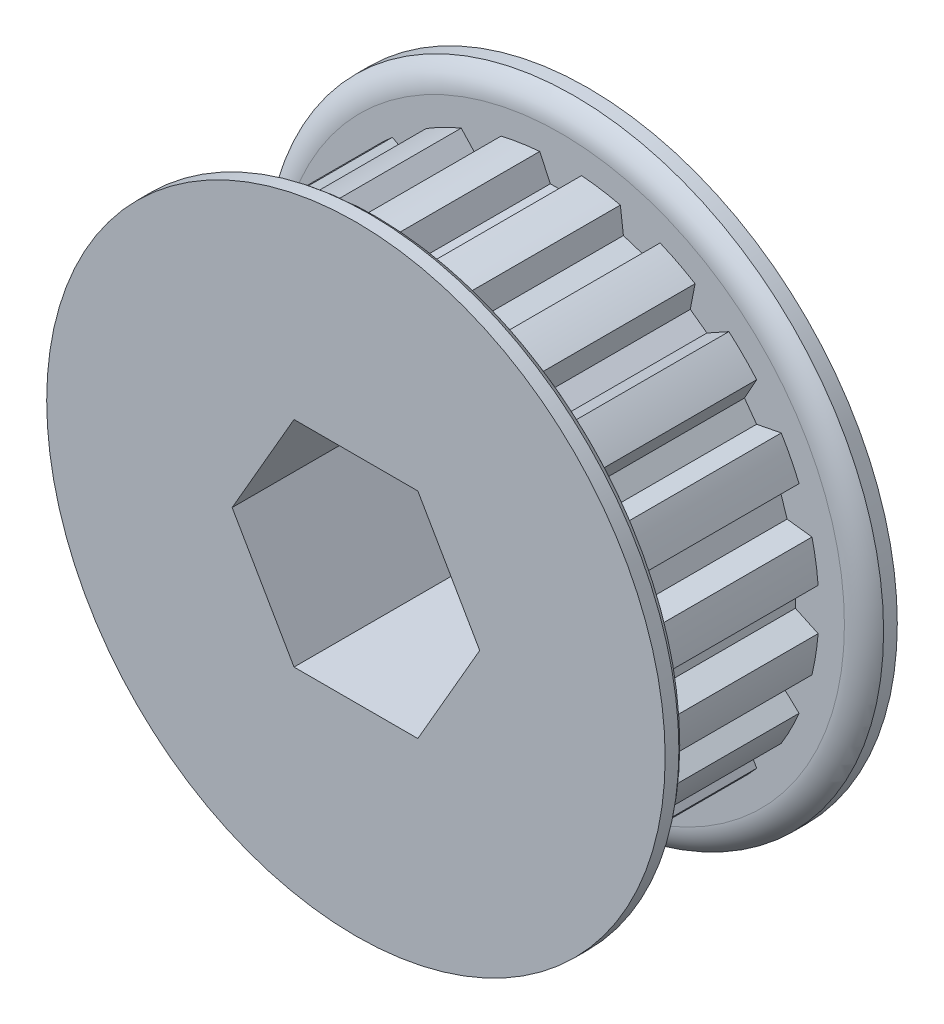
from build123d import *

# Parameters (mm, degrees)
CUT_EXTRUDE1_START = 1.4986
CUT_EXTRUDE1_DEPTH = 10.922
CIRPATTERN1_COUNT  = 20
SKETCH4_R          = 2.38125
CUT_EXTRUDE2_DEPTH = 30.142626104
CUT_EXTRUDE3_DEPTH = 1.7859375
CIRPATTERN2_COUNT  = 2
CIRPATTERN2_ANGLE  = 90
CUT_EXTRUDE4_DEPTH = 35.925000064
SKETCH8_R          = 14.509078941
CUT_EXTRUDE5_DEPTH = 31.500831465


with BuildPart() as part:
    # Sketch2 → Revolve1 (revolve)
    with BuildSketch(Plane(origin=(0, 0, 0), x_dir=(0, 0, -1), z_dir=(1, 0, 0)), mode=Mode.PRIVATE) as revolve1_sk:
        with BuildLine():
            Line((-11.1125, 6.35), (11.1125, 6.35))
            Line((11.1125, 6.35), (11.1125, 19.05))
            Line((11.1125, 19.05), (10.26795, 19.05))
            ThreePointArc((10.26795, 19.05), (9.647958091, 18.372237951), (9.4234, 17.48155))
            Line((9.4234, 17.48155), (9.4234, 15.9131))
            Line((9.4234, 15.9131), (-1.4986, 15.9131))
            Line((-1.4986, 15.9131), (-1.4986, 17.48155))
            ThreePointArc((-1.4986, 17.48155), (-1.723158091, 18.372237951), (-2.34315, 19.05))
            Line((-2.34315, 19.05), (-3.1877, 19.05))
            Line((-3.1877, 19.05), (-3.1877, 11.8999))
            Line((-3.1877, 11.8999), (-11.1125, 11.8999))
            Line((-11.1125, 11.8999), (-11.1125, 6.35))
        make_face()
    revolve(revolve1_sk.sketch.rotate(Axis((0, 0, 11.1125), (0, 0, -1)), 90), axis=Axis((0, 0, 11.1125), (0, 0, -1)))

    # Sketch3 → Cut-Extrude1 (cut)
    with BuildSketch(Plane.XY.offset(CUT_EXTRUDE1_START)):
        with BuildLine():
            Line((-0.635, 14.46090299), (0.635, 14.46090299))
            Line((0.635, 14.46090299), (1.287830721, 15.86090299))
            ThreePointArc((1.287830721, 15.86090299), (0, 15.9131), (-1.287830721, 15.86090299))
            Line((-1.287830721, 15.86090299), (-0.635, 14.46090299))
        make_face()
    cut_extrude1 = extrude(amount=-CUT_EXTRUDE1_DEPTH, mode=Mode.SUBTRACT)

    # CirPattern1: Cut-Extrude1 ×20 about axis
    cirpattern1_axis = Axis((0, 0, 0), (0, 0, 1))
    for i in range(1, CIRPATTERN1_COUNT):
        add(cut_extrude1.rotate(cirpattern1_axis, i * 360 / CIRPATTERN1_COUNT), mode=Mode.SUBTRACT)

    # Sketch4 → Cut-Extrude2 (cut, through all)
    with BuildSketch(Plane(origin=(0, 0, 0), x_dir=(1, 0, 0), z_dir=(0, 1, 0))):
        with Locations(Location((0, -7.1501, 0), (0, 0, 90))):
            Circle(SKETCH4_R)
    cut_extrude2 = extrude(amount=CUT_EXTRUDE2_DEPTH, mode=Mode.SUBTRACT)

    # Sketch5 → Revolve2 (revolve)
    with BuildSketch(Plane.XY.offset(7.1501), mode=Mode.PRIVATE) as revolve2_sk:
        Polygon((1.87325, 11.659213886), (2.38125, 11.151213886), (2.38125, 6.985), (1.74625, 6.35), (0, 6.35), (0, 11.659213886), align=None)
    revolve2 = revolve(revolve2_sk.sketch.rotate(Axis((0, 0, 7.1501), (0, 1, 0)), 90), axis=Axis((0, 0, 7.1501), (0, 1, 0)))

    # Sketch6 → Cut-Extrude3 (cut)
    with BuildSketch(Plane(origin=(0, 11.659213886, 0), x_dir=(1, 0, 0), z_dir=(0, 1, 0))):
        Polygon((0, -5.775284671), (-1.190625, -6.462692336), (-1.190625, -7.837507664), (0, -8.524915329), (1.190625, -7.837507664), (1.190625, -6.462692336), align=None)
    cut_extrude3 = extrude(amount=-CUT_EXTRUDE3_DEPTH, mode=Mode.SUBTRACT)

    # CirPattern2: Cut-Extrude2, Revolve2, Cut-Extrude3 ×2 about axis
    cirpattern2_axis = Axis((0, 0, 0), (0, 0, -1))
    add([cut_extrude2.rotate(cirpattern2_axis, i * CIRPATTERN2_ANGLE / (CIRPATTERN2_COUNT - 1)) for i in range(1, CIRPATTERN2_COUNT)], mode=Mode.SUBTRACT)
    add([revolve2.rotate(cirpattern2_axis, i * CIRPATTERN2_ANGLE / (CIRPATTERN2_COUNT - 1)) for i in range(1, CIRPATTERN2_COUNT)])
    add([cut_extrude3.rotate(cirpattern2_axis, i * CIRPATTERN2_ANGLE / (CIRPATTERN2_COUNT - 1)) for i in range(1, CIRPATTERN2_COUNT)], mode=Mode.SUBTRACT)

    # Sketch7 → Cut-Extrude4 (cut, through all)
    with BuildSketch(Plane(origin=(0, 0, -11.1125), x_dir=(-1, 0, 0), z_dir=(0, 0, -1))):
        Polygon((3.812821178, -6.604), (7.625642355, 0), (3.812821178, 6.604), (-3.812821178, 6.604), (-7.625642355, 0), (-3.812821178, -6.604), align=None)
    extrude(amount=-CUT_EXTRUDE4_DEPTH, mode=Mode.SUBTRACT)

    # Sketch8 → Cut-Extrude5 (cut, through all)
    with BuildSketch(Plane.XY.offset(3.1877)):
        Circle(SKETCH8_R)
    extrude(amount=CUT_EXTRUDE5_DEPTH, mode=Mode.SUBTRACT)


solid = part.part
